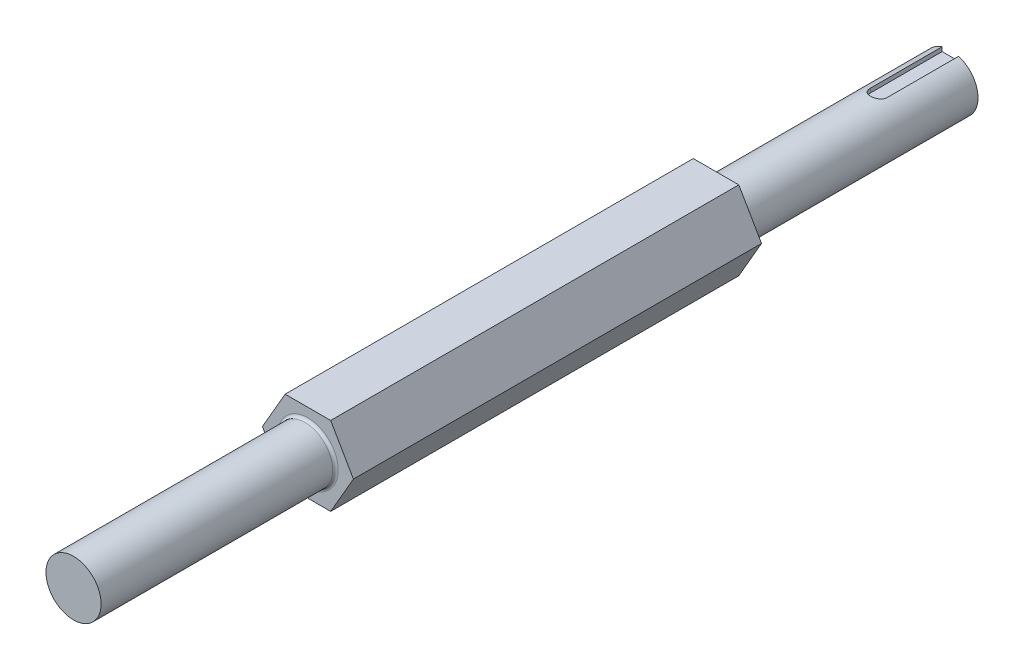
from build123d import *

# Parameters (mm, degrees)
BOSS_EXTRUDE1_DEPTH = 74
SKETCH2_R           = 10
BOSS_EXTRUDE2_DEPTH = 85
FILLET1_R           = 1
CUT_EXTRUDE1_DEPTH  = 2


with BuildPart() as part:
    # Sketch1 → Boss-Extrude1 (new, symmetric)
    with BuildSketch(Plane.XY):
        Polygon((16.500670693, 0), (8.250335347, 14.29), (-8.250335347, 14.29), (-16.500670693, 0), (-8.250335347, -14.29), (8.250335347, -14.29), align=None)
    extrude(amount=BOSS_EXTRUDE1_DEPTH, both=True)

    # Sketch2 → Boss-Extrude2 (add)
    with BuildSketch(Plane.XY.offset(74)):
        Circle(SKETCH2_R)
    boss_extrude2 = extrude(amount=BOSS_EXTRUDE2_DEPTH)

    # Mirror3: Boss-Extrude2 across plane
    add(boss_extrude2.mirror(Plane.XY))

    # Fillet1
    fillet1_edges = [part.edges().sort_by_distance(p)[0] for p in [
        (-10, 0, 74),
        (-10, 0, -74),
    ]]
    fillet(fillet1_edges, radius=FILLET1_R)

    # Sketch3 → Cut-Extrude1 (cut)
    with BuildSketch(Plane(origin=(0, 10, 0), x_dir=(1, 0, 0), z_dir=(0, 1, 0))):
        with BuildLine():
            Line((3, 133), (3, 159))
            Line((3, 159), (-3, 159))
            Line((-3, 159), (-3, 133))
            ThreePointArc((-3, 133), (0, 130), (3, 133))
        make_face()
    extrude(amount=-CUT_EXTRUDE1_DEPTH, mode=Mode.SUBTRACT)


solid = part.part
